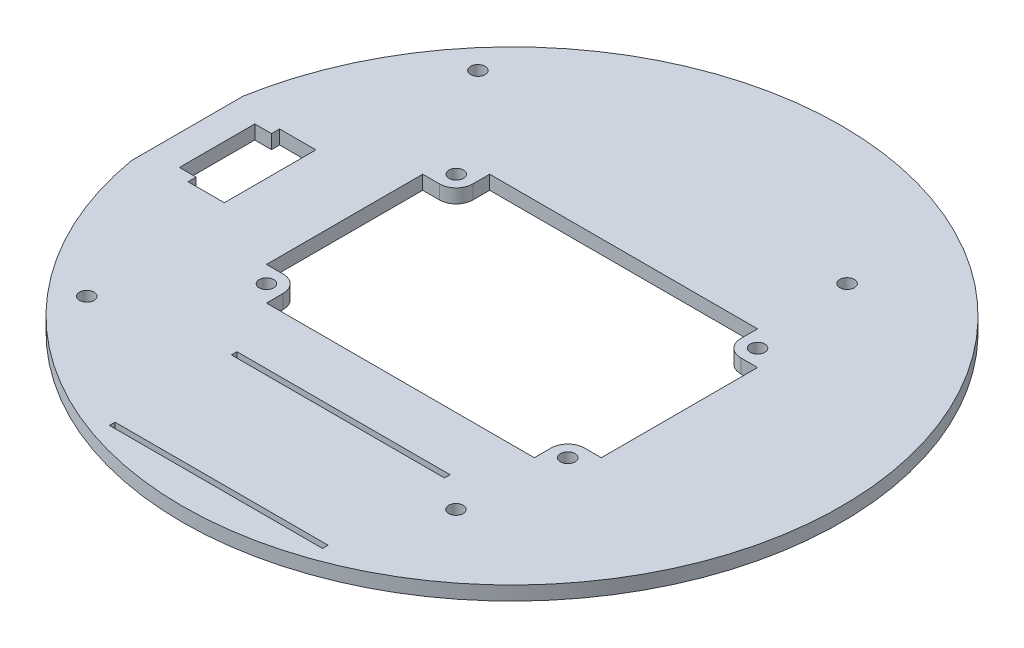
from build123d import *

# Parameters (mm, degrees)
SKETCH1_R           = 1.651
SKETCH1_W           = 48.5
SKETCH1_H           = 1.27
BOSS_EXTRUDE1_DEPTH = 3.175


with BuildPart() as part:
    # Sketch1 → Boss-Extrude1 (new body)
    with BuildSketch(Plane(origin=(0, 0, 0), x_dir=(1, 0, 0), z_dir=(0, 1, 0))):
        with BuildLine():
            Line((-73.916912814, 12.7), (-73.916912814, -12.7))
            ThreePointArc((-73.916912814, -12.7), (75, 0), (-73.916912814, 12.7))
        make_face()
        with Locations(Location((-52.26766059, -44.507461806, 0), (0, 0, 270))):
            Circle(SKETCH1_R, mode=Mode.SUBTRACT)
        with Locations(Location((31.75, -44.507461806, 0), (0, 0, 270))):
            Circle(SKETCH1_R, mode=Mode.SUBTRACT)
        with Locations(Location((31.75, 44.507461806, 0), (0, 0, 270))):
            Circle(SKETCH1_R, mode=Mode.SUBTRACT)
        with Locations(Location((-52.26766059, 44.507461806, 0), (0, 0, 270))):
            Circle(SKETCH1_R, mode=Mode.SUBTRACT)
        with Locations(Location((34.29, 21.59, 0), (0, 0, 270))):
            Circle(SKETCH1_R, mode=Mode.SUBTRACT)
        with Locations(Location((34.29, -21.59, 0), (0, 0, 270))):
            Circle(SKETCH1_R, mode=Mode.SUBTRACT)
        with Locations(Location((-34.29, -21.59, 0), (0, 0, 270))):
            Circle(SKETCH1_R, mode=Mode.SUBTRACT)
        with Locations(Location((-34.29, 21.59, 0), (0, 0, 270))):
            Circle(SKETCH1_R, mode=Mode.SUBTRACT)
        with BuildLine():
            Line((-30.48, 21.59), (-30.48, 25.4))
            Line((-30.48, 25.4), (30.48, 25.4))
            Line((30.48, 25.4), (30.48, 21.59))
            ThreePointArc((30.48, 21.59), (31.595923164, 18.895923164), (34.29, 17.78))
            Line((34.29, 17.78), (38.1, 17.78))
            Line((38.1, 17.78), (38.1, -17.78))
            Line((38.1, -17.78), (34.29, -17.78))
            ThreePointArc((34.29, -17.78), (31.595923164, -18.895923164), (30.48, -21.59))
            Line((30.48, -21.59), (30.48, -25.4))
            Line((30.48, -25.4), (-30.48, -25.4))
            Line((-30.48, -25.4), (-30.48, -21.59))
            ThreePointArc((-30.48, -21.59), (-31.595923164, -18.895923164), (-34.29, -17.78))
            Line((-34.29, -17.78), (-38.1, -17.78))
            Line((-38.1, -17.78), (-38.1, 17.78))
            Line((-38.1, 17.78), (-34.29, 17.78))
            ThreePointArc((-34.29, 17.78), (-31.595923164, 18.895923164), (-30.48, 21.59))
        make_face(mode=Mode.SUBTRACT)
        Polygon((-67.114917129, 8.5725), (-63.304917129, 8.5725), (-63.304917129, 10.414), (-55.049917129, 10.414), (-55.049917129, 8.5725), (-55.049917129, -8.5725), (-55.049917129, -10.414), (-63.304917129, -10.414), (-63.304917129, -8.5725), (-67.114917129, -8.5725), align=None, mode=Mode.SUBTRACT)
        with Locations((0, -38.975)):
            Rectangle(SKETCH1_W, SKETCH1_H, mode=Mode.SUBTRACT)
        with Locations((0, -66.745)):
            Rectangle(SKETCH1_W, SKETCH1_H, mode=Mode.SUBTRACT)
    extrude(amount=BOSS_EXTRUDE1_DEPTH)


solid = part.part
